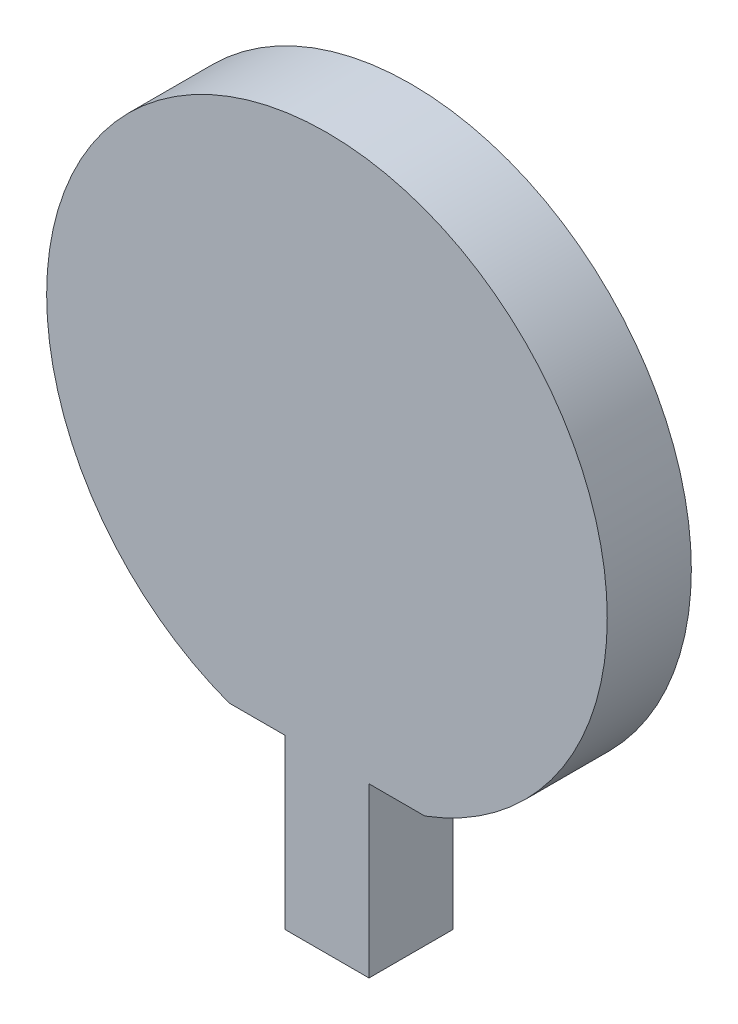
from build123d import *

# Parameters (mm, degrees)
BOSS_EXTRUDE1_DEPTH = 15


with BuildPart() as part:
    # Sketch1 → Boss-Extrude1 (new body)
    with BuildSketch(Plane.XY):
        with BuildLine():
            Line((-9.95288323, 30), (0, 30))
            Line((0, 30), (0, 0))
            Line((0, 0), (15, 0))
            Line((15, 0), (15, 30))
            Line((15, 30), (24.95288323, 30))
            ThreePointArc((24.95288323, 30), (7.5, 126.855062341), (-9.95288323, 30))
        make_face()
    extrude(amount=BOSS_EXTRUDE1_DEPTH)


solid = part.part
